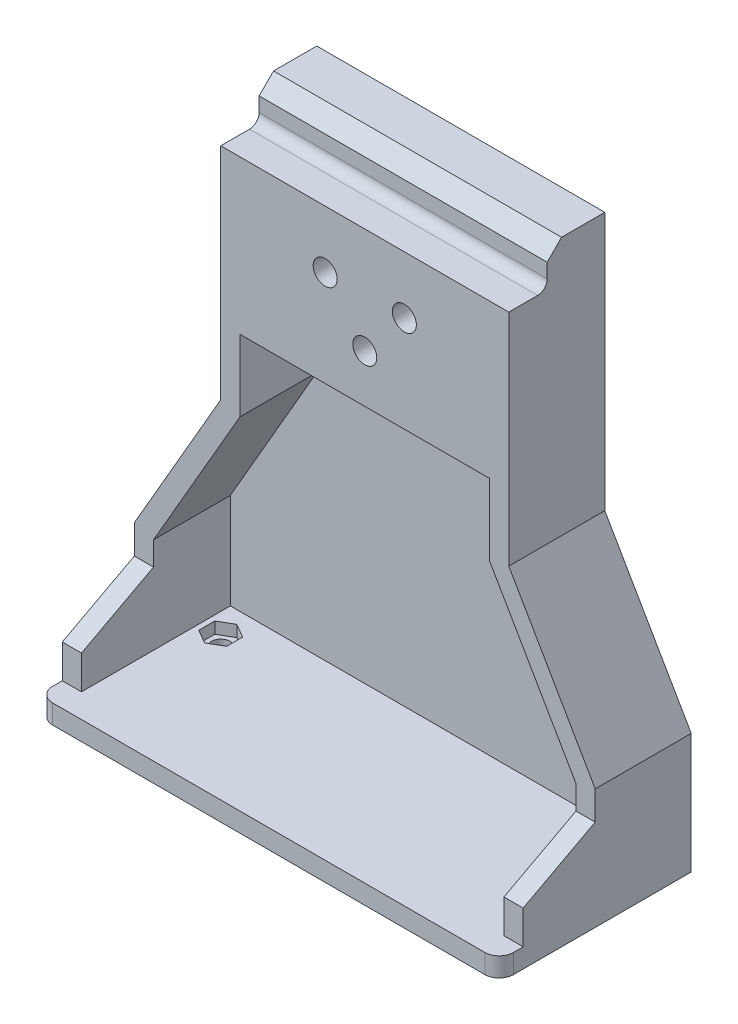
from build123d import *

# Parameters (mm, degrees)
SKETCH_1_W                 = 96
SKETCH_1_H                 = 110
EXTRUDE_1_DEPTH            = 20
CUT_EXTRUDE_1_DEPTH        = 20
SHELL_1_T                  = -4
SHELL_1_THICKNESS_2_FACE_W = 16
SHELL_1_THICKNESS_2_FACE_H = 52
SHELL_1_THICKNESS_2_DEPTH  = 36
CUT_EXTRUDE_2_REACH        = 123.672
SKETCH_3_R                 = 2
CUT_EXTRUDE_3_REACH        = 77.69
SKETCH_5_R                 = 2.5
SKETCH_6_W                 = 96
SKETCH_6_H                 = 20
EXTRUDE_2_DEPTH            = 4
EXTRUDE_3_DEPTH            = 4
FILLET_1_R                 = 3
CUT_EXTRUDE_4_DEPTH        = 2.4
SKETCH_10_W                = 8
SKETCH_10_H                = 8
CUT_EXTRUDE_5_DEPTH        = 104.484298326
FILLET_2_R                 = 2
CHAMFER_1_SIZE             = 3


with BuildPart() as part:
    # 草图1 → 凸台-拉伸1 (new body)
    with BuildSketch(Plane.XY):
        Rectangle(SKETCH_1_W, SKETCH_1_H)
    extrude(amount=EXTRUDE_1_DEPTH)

    # 草图2 → 切除-拉伸1 (cut)
    with BuildSketch(Plane.XY.offset(20)):
        Polygon((-48, -30), (-30, 1.176914536), (-30, 55), (-48, 55), align=None)
        Polygon((48, 55), (48, -30), (30, 1.176914536), (30, 55), align=None)
    extrude(amount=-CUT_EXTRUDE_1_DEPTH, mode=Mode.SUBTRACT)

    # 抽壳1
    shell_1_openings = [part.faces().sort_by_distance(p)[0] for p in [
        (0, -6.109962386, 20),
    ]]
    offset(amount=SHELL_1_T, openings=shell_1_openings, kind=Kind.INTERSECTION)

    # 抽壳1 thickness 2 face (on inner face of the shell) → 抽壳1 thickness 2 (add)
    with BuildSketch(Plane(origin=(0, 51, 12), x_dir=(0, 0, 1), z_dir=(0, 1, 0))):
        Rectangle(SHELL_1_THICKNESS_2_FACE_W, SHELL_1_THICKNESS_2_FACE_H)
    extrude(amount=-SHELL_1_THICKNESS_2_DEPTH)

    # 草图3 → 切除-拉伸2 (cut, up to next)
    with BuildSketch(Plane.XZ.offset(55), mode=Mode.PRIVATE) as cut_extrude_2_sk1:
        with Locations(Location((-40, 10, 0), (0, 0, 270))):
            Circle(SKETCH_3_R)
    cut_extrude_2_tool1 = extrude(cut_extrude_2_sk1.sketch, amount=-CUT_EXTRUDE_2_REACH, mode=Mode.PRIVATE) & part.part
    # 草图3 → 切除-拉伸2 (cut, up to next)
    with BuildSketch(Plane.XZ.offset(55), mode=Mode.PRIVATE) as cut_extrude_2_sk2:
        with Locations(Location((40, 10, 0), (0, 0, 270))):
            Circle(SKETCH_3_R)
    cut_extrude_2_tool2 = extrude(cut_extrude_2_sk2.sketch, amount=-CUT_EXTRUDE_2_REACH, mode=Mode.PRIVATE) & part.part
    add(cut_extrude_2_tool1.solids().sort_by_distance((-40, -55, 10))[0], mode=Mode.SUBTRACT)
    add(cut_extrude_2_tool2.solids().sort_by_distance((40, -55, 10))[0], mode=Mode.SUBTRACT)

    # 草图5 → 切除-拉伸3 (cut, up to next)
    with BuildSketch(Plane.XY.offset(20), mode=Mode.PRIVATE) as cut_extrude_3_sk1:
        with Locations((0, 25)):
            Circle(SKETCH_5_R)
    cut_extrude_3_tool1 = extrude(cut_extrude_3_sk1.sketch, amount=-CUT_EXTRUDE_3_REACH, mode=Mode.PRIVATE) & part.part
    # 草图5 → 切除-拉伸3 (cut, up to next)
    with BuildSketch(Plane.XY.offset(20), mode=Mode.PRIVATE) as cut_extrude_3_sk2:
        with Locations((-8.25, 35.046765649)):
            Circle(SKETCH_5_R)
    cut_extrude_3_tool2 = extrude(cut_extrude_3_sk2.sketch, amount=-CUT_EXTRUDE_3_REACH, mode=Mode.PRIVATE) & part.part
    # 草图5 → 切除-拉伸3 (cut, up to next)
    with BuildSketch(Plane.XY.offset(20), mode=Mode.PRIVATE) as cut_extrude_3_sk3:
        with Locations(Location((8.25, 35.046765649, 0), (0, 0, 180))):
            Circle(SKETCH_5_R)
    cut_extrude_3_tool3 = extrude(cut_extrude_3_sk3.sketch, amount=-CUT_EXTRUDE_3_REACH, mode=Mode.PRIVATE) & part.part
    add(cut_extrude_3_tool1.solids().sort_by_distance((0, 25, 20))[0], mode=Mode.SUBTRACT)
    add(cut_extrude_3_tool2.solids().sort_by_distance((-8.25, 35.046766, 20))[0], mode=Mode.SUBTRACT)
    add(cut_extrude_3_tool3.solids().sort_by_distance((8.25, 35.046766, 20))[0], mode=Mode.SUBTRACT)

    # 草图6 → 凸台-拉伸2 (add)
    with BuildSketch(Plane.XZ.offset(55)):
        with Locations((0, 30)):
            Rectangle(SKETCH_6_W, SKETCH_6_H)
    extrude(amount=-EXTRUDE_2_DEPTH)

    # 草图7 → 凸台-拉伸3 (add)
    with BuildSketch(Plane.ZY.offset(48)):
        Polygon((20, -36), (35, -44), (35, -51), (20, -51), align=None)
    extrude_3 = extrude(amount=-EXTRUDE_3_DEPTH)

    # 镜向1: 凸台-拉伸3 across plane
    add(extrude_3.mirror(Plane(origin=(0, 0, 0), x_dir=(0, 0, 1), z_dir=(1, 0, 0))))

    # 圆角1
    fillet_1_edges = [part.edges().sort_by_distance(p)[0] for p in [
        (-48, -53, 40),
        (48, -53, 40),
    ]]
    fillet(fillet_1_edges, radius=FILLET_1_R)

    # 草图8 → 切除-拉伸4 (cut)
    with BuildSketch(Plane(origin=(0, -51, 0), x_dir=(1, 0, 0), z_dir=(0, 1, 0))):
        Polygon((40, -13.348631561), (42.9, -11.674315781), (42.9, -8.325684219), (40, -6.651368439), (37.1, -8.325684219), (37.1, -11.674315781), align=None)
        Polygon((-37.1, -11.674315781), (-40, -13.348631561), (-42.9, -11.674315781), (-42.9, -8.325684219), (-40, -6.651368439), (-37.1, -8.325684219), align=None)
    extrude(amount=-CUT_EXTRUDE_4_DEPTH, mode=Mode.SUBTRACT)

    # 草图10 → 切除-拉伸5 (cut, through all)
    with BuildSketch(Plane.ZY.offset(30)):
        with Locations((16, 51)):
            Rectangle(SKETCH_10_W, SKETCH_10_H)
    extrude(amount=-CUT_EXTRUDE_5_DEPTH, mode=Mode.SUBTRACT)

    # 圆角2
    fillet_2_edges = [part.edges().sort_by_distance(p)[0] for p in [
        (0, 47, 12),
    ]]
    fillet(fillet_2_edges, radius=FILLET_2_R)

    # 倒角1
    chamfer_1_edges = [part.edges().sort_by_distance(p)[0] for p in [
        (0, 55, 12),
    ]]
    chamfer(chamfer_1_edges, length=CHAMFER_1_SIZE)


solid = part.part
